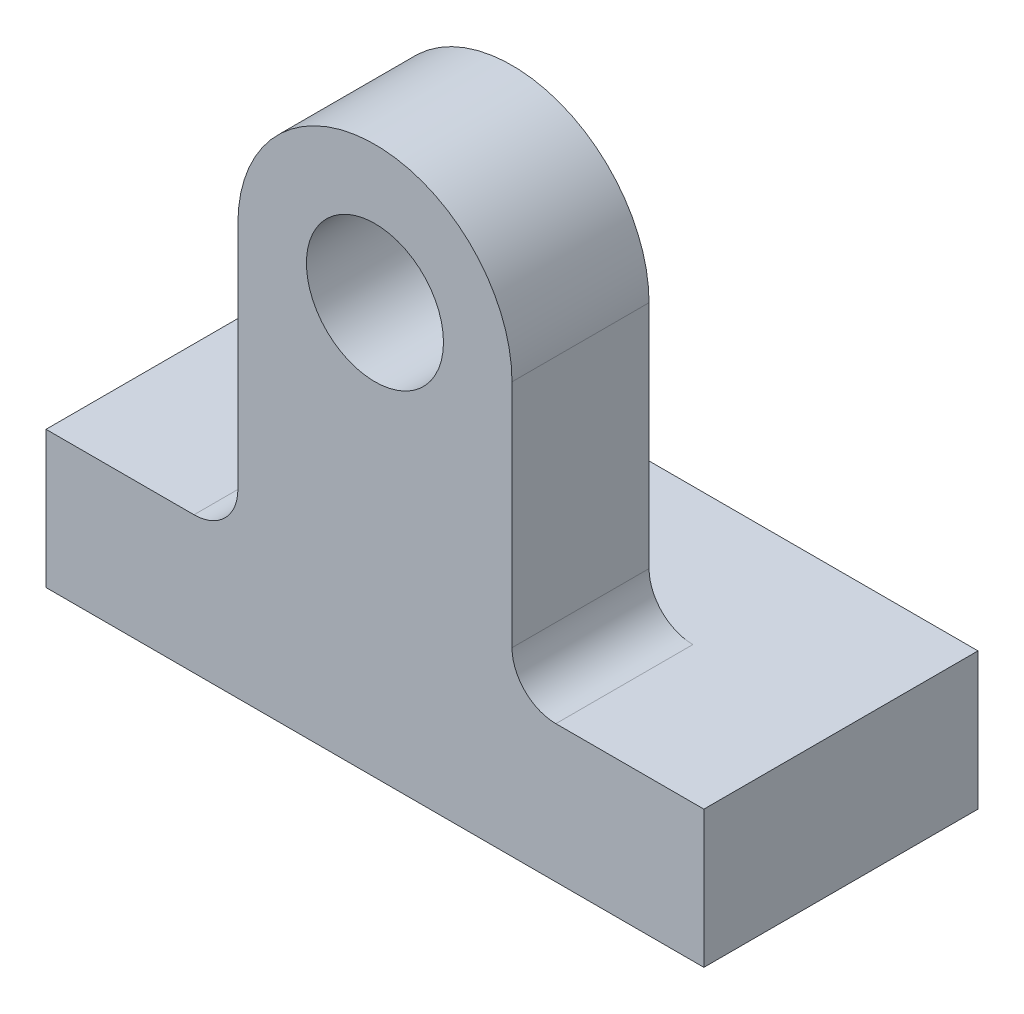
from build123d import *

# Parameters (mm, degrees)
BOSS_EXTRUDE3_DEPTH = 50
SKETCH3_R           = 12.5
BOSS_EXTRUDE4_DEPTH = 25
FILLET1_R           = 8


with BuildPart() as part:
    # Sketch1 → Boss-Extrude3 (new body)
    with BuildSketch(Plane.XY):
        Polygon((25, 25), (0, 25), (0, 0), (60, 0), (60, 25), align=None)
        Polygon((0, 0), (0, 25), (-25, 25), (-60, 25), (-60, 0), align=None)
    extrude(amount=BOSS_EXTRUDE3_DEPTH)

    # Sketch3 → Boss-Extrude4 (add)
    with BuildSketch(Plane.XY.offset(50)):
        with BuildLine():
            Line((-25, 75), (-25, 25))
            Line((-25, 25), (25, 25))
            Line((25, 25), (25, 75))
            ThreePointArc((25, 75), (0, 100), (-25, 75))
        make_face()
        with Locations((0, 75)):
            Circle(SKETCH3_R, mode=Mode.SUBTRACT)
    extrude(amount=-BOSS_EXTRUDE4_DEPTH)

    # Fillet1
    fillet1_edges = [part.edges().sort_by_distance(p)[0] for p in [
        (25, 25, 37.5),
        (-25, 25, 37.5),
    ]]
    fillet(fillet1_edges, radius=FILLET1_R)


solid = part.part
